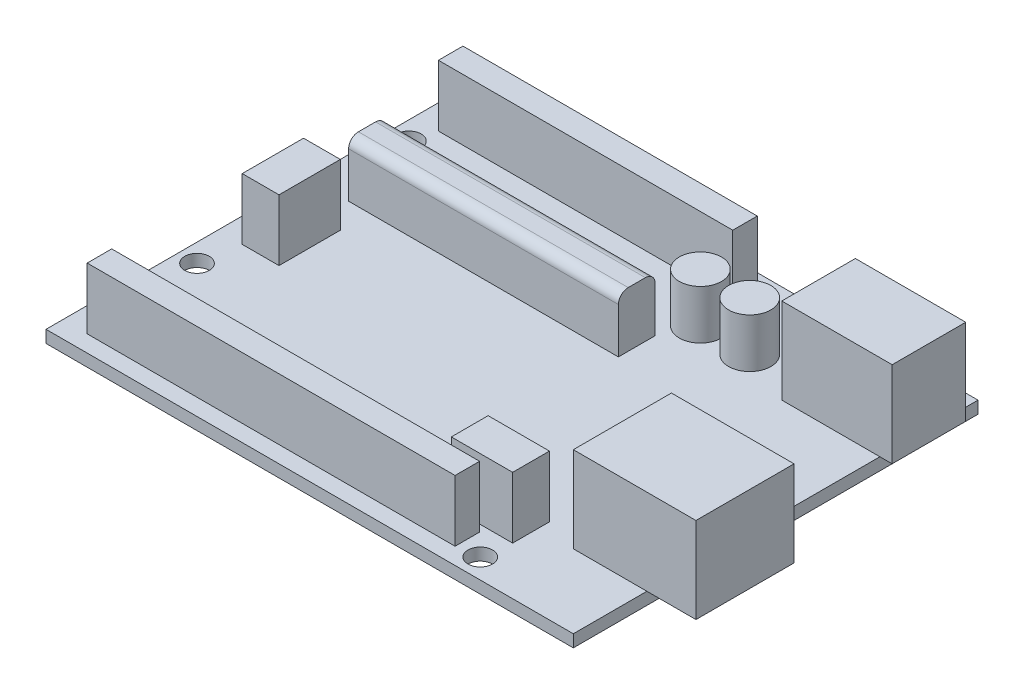
from build123d import *

# Parameters (mm, degrees)
SKETCH2_W           = 68.2625
SKETCH2_H           = 52.3875
BOSS_EXTRUDE1_DEPTH = 1.5875
SKETCH3_W           = 38.1
SKETCH3_H           = 3.175
SKETCH3_W_2         = 47.625
SKETCH3_W_3         = 4.7625
SKETCH3_H_2         = 7.9375
SKETCH3_W_4         = 7.9375
SKETCH3_H_3         = 4.7625
BOSS_EXTRUDE2_DEPTH = 7.9375
SKETCH5_W           = 34.925
SKETCH5_H           = 4.7625
BOSS_EXTRUDE3_DEPTH = 7.14375
FILLET1_R           = 1.27
SKETCH6_R           = 2.737420774
BOSS_EXTRUDE4_DEPTH = 6.35
SKETCH7_W           = 15.875
SKETCH7_H           = 12.7
BOSS_EXTRUDE5_DEPTH = 11.1125
SKETCH8_W           = 14.2875
SKETCH8_H           = 9.525
BOSS_EXTRUDE6_DEPTH = 11.1125
SKETCH9_R           = 1.5875
CUT_EXTRUDE1_DEPTH  = 1.5875


with BuildPart() as part:
    # Sketch2 → Boss-Extrude1 (new body)
    with BuildSketch(Plane(origin=(0, 0, 0), x_dir=(1, 0, 0), z_dir=(0, 1, 0))):
        with Locations((34.13125, 26.19375)):
            Rectangle(SKETCH2_W, SKETCH2_H)
    extrude(amount=BOSS_EXTRUDE1_DEPTH)

    # Sketch3 → Boss-Extrude2 (add)
    with BuildSketch(Plane(origin=(0, 1.5875, 0), x_dir=(1, 0, 0), z_dir=(0, 1, 0))):
        with Locations((22.225, 49.2125)):
            Rectangle(SKETCH3_W, SKETCH3_H)
        with Locations((26.9875, 3.743785618)):
            Rectangle(SKETCH3_W_2, SKETCH3_H)
        with Locations((5.56088816, 26.190824392)):
            Rectangle(SKETCH3_W_3, SKETCH3_H_2)
        with Locations((50.20501244, 8.616122464)):
            Rectangle(SKETCH3_W_4, SKETCH3_H_3)
    extrude(amount=BOSS_EXTRUDE2_DEPTH)

    # Sketch5 → Boss-Extrude3 (add)
    with BuildSketch(Plane(origin=(0, 1.5875, 0), x_dir=(1, 0, 0), z_dir=(0, 1, 0))):
        with Locations((22.684927586, 36.331025526)):
            Rectangle(SKETCH5_W, SKETCH5_H)
    extrude(amount=BOSS_EXTRUDE3_DEPTH)

    # Fillet1
    fillet1_edges = [part.edges().sort_by_distance(p)[0] for p in [
        (22.684927586, 8.73125, -33.949775526),
        (22.684927586, 8.73125, -38.712275526),
    ]]
    fillet(fillet1_edges, radius=FILLET1_R)

    # Sketch6 → Boss-Extrude4 (add)
    with BuildSketch(Plane(origin=(0, 1.5875, 0), x_dir=(1, 0, 0), z_dir=(0, 1, 0))):
        with Locations(Location((41.97022767, 42.74270286, 0), (0, 0, 90))):
            Circle(SKETCH6_R)
        with Locations(Location((48.357542809, 42.74270286, 0), (0, 0, 90))):
            Circle(SKETCH6_R)
    extrude(amount=BOSS_EXTRUDE4_DEPTH)

    # Sketch7 → Boss-Extrude5 (add)
    with BuildSketch(Plane(origin=(0, 1.5875, 0), x_dir=(1, 0, 0), z_dir=(0, 1, 0))):
        with Locations((66.675, 15.875)):
            Rectangle(SKETCH7_W, SKETCH7_H)
    extrude(amount=BOSS_EXTRUDE5_DEPTH)

    # Sketch8 → Boss-Extrude6 (add)
    with BuildSketch(Plane(origin=(0, 1.5875, 0), x_dir=(1, 0, 0), z_dir=(0, 1, 0))):
        with Locations((62.70625, 44.45)):
            Rectangle(SKETCH8_W, SKETCH8_H)
    extrude(amount=BOSS_EXTRUDE6_DEPTH)

    # Sketch9 → Cut-Extrude1 (cut)
    with BuildSketch(Plane.XZ):
        with Locations(Location((53.637787609, -2.580775526, 0), (0, 0, 270))):
            Circle(SKETCH9_R)
        with Locations(Location((54.45125, -49.806724474, 0), (0, 0, 21.981959095))):
            Circle(SKETCH9_R)
        with Locations(Location((2.38125, -44.599724474, 0), (0, 0, 270))):
            Circle(SKETCH9_R)
        with Locations(Location((2.38125, -17.167724474, 0), (0, 0, 270))):
            Circle(SKETCH9_R)
    extrude(amount=-CUT_EXTRUDE1_DEPTH, mode=Mode.SUBTRACT)


solid = part.part
